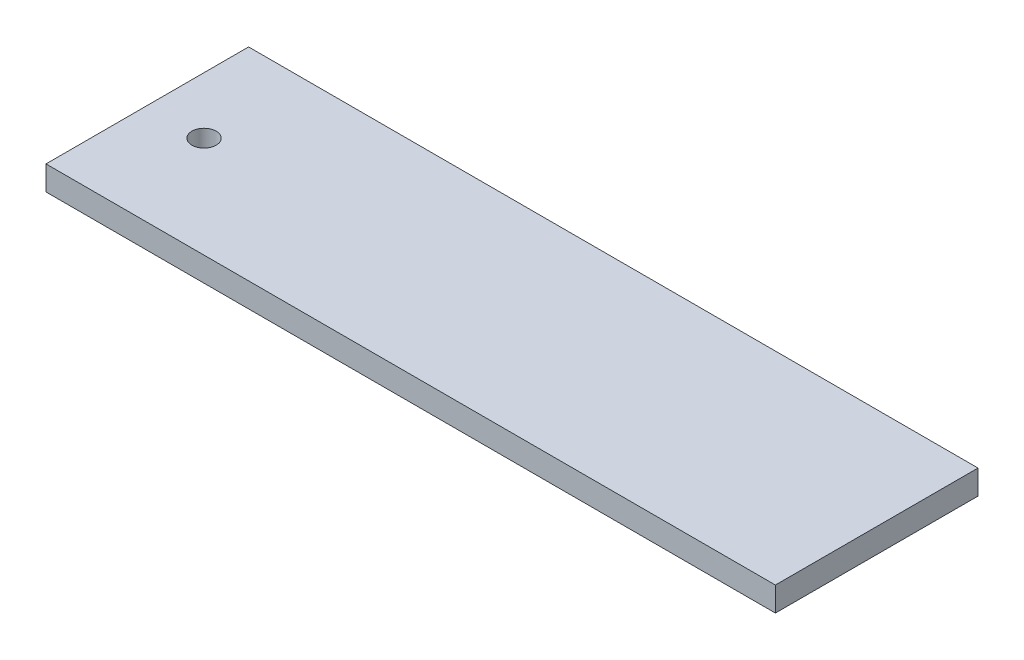
from build123d import *

# Parameters (mm, degrees)
SKETCH1_W           = 90
SKETCH1_H           = 25
BOSS_EXTRUDE1_DEPTH = 3
SKETCH2_R           = 1.5
CUT_EXTRUDE1_DEPTH  = 10


with BuildPart() as part:
    # Sketch1 → Boss-Extrude1 (new body)
    with BuildSketch(Plane(origin=(0, 0, 0), x_dir=(1, 0, 0), z_dir=(0, 1, 0))):
        Rectangle(SKETCH1_W, SKETCH1_H)
    extrude(amount=BOSS_EXTRUDE1_DEPTH)

    # Sketch2 → Cut-Extrude1 (cut)
    with BuildSketch(Plane(origin=(0, 3, 0), x_dir=(1, 0, 0), z_dir=(0, 1, 0))):
        with Locations(Location((-38, 0, 0), (0, 0, 270))):
            Circle(SKETCH2_R)
    extrude(amount=-CUT_EXTRUDE1_DEPTH, mode=Mode.SUBTRACT)


solid = part.part
